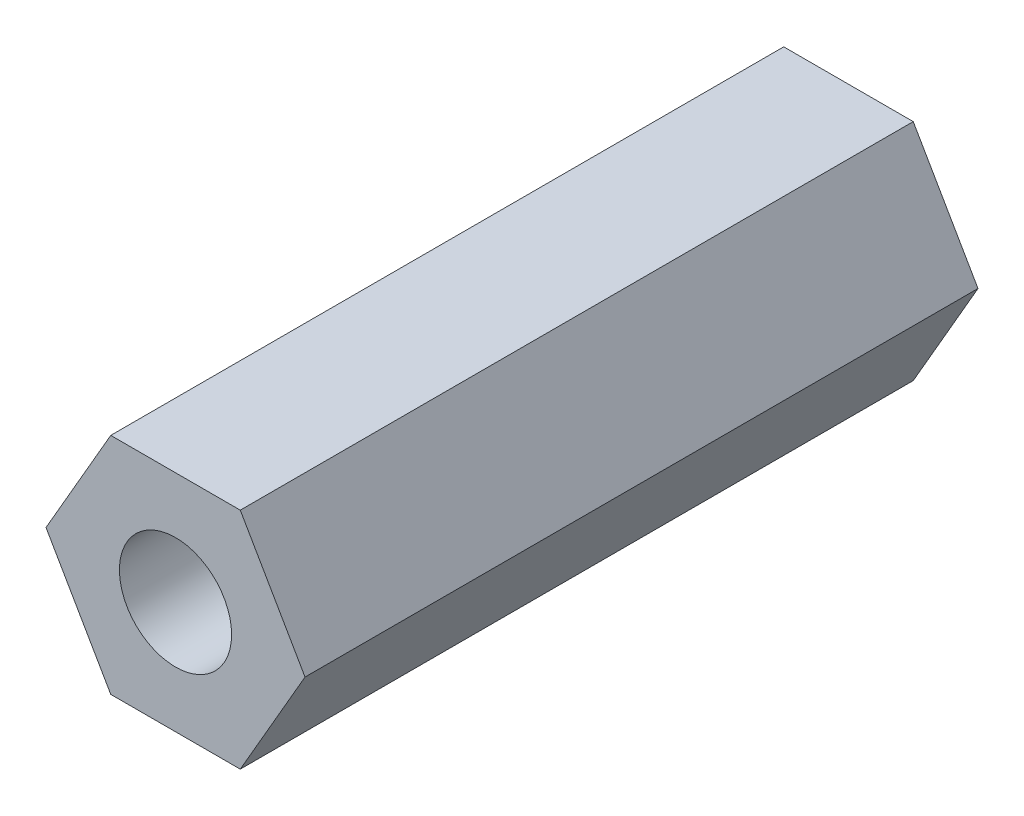
from build123d import *

# Parameters (mm, degrees)
BOSS_EXTRUDE1_DEPTH = 30
SKETCH2_R           = 2.5
CUT_EXTRUDE1_DEPTH  = 20


with BuildPart() as part:
    # Sketch1 → Boss-Extrude1 (new body)
    with BuildSketch(Plane.XY):
        Polygon((-5.773502692, 0), (-2.886751346, -5), (2.886751346, -5), (5.773502692, 0), (2.886751346, 5), (-2.886751346, 5), align=None)
    extrude(amount=BOSS_EXTRUDE1_DEPTH)

    # Sketch2 → Cut-Extrude1 (cut)
    with BuildSketch(Plane.XY.offset(30)):
        Circle(SKETCH2_R)
    cut_extrude1 = extrude(amount=-CUT_EXTRUDE1_DEPTH, mode=Mode.SUBTRACT)

    # Mirror1: Cut-Extrude1 across plane
    add(cut_extrude1.mirror(Plane.XY.offset(15)), mode=Mode.SUBTRACT)


solid = part.part
